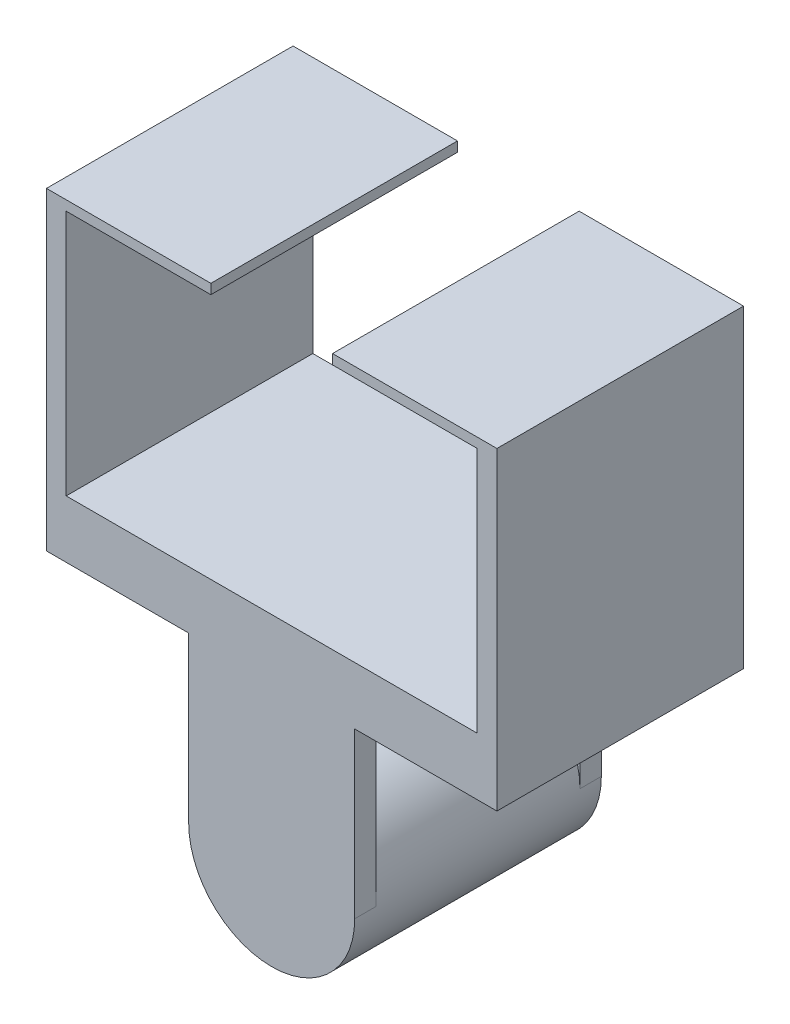
from build123d import *

# Parameters (mm, degrees)
SKETCH1_R            = 12.827
BOSS_EXTRUDE1_DEPTH  = 38.1
SKETCH2_W            = 25.654
SKETCH2_H            = 25.4
BOSS_EXTRUDE2_DEPTH  = 3.302
SKETCH8_W            = 63.5
SKETCH8_H            = 38.1
BOSS_EXTRUDE6_DEPTH  = 8.89
SKETCH10_W           = 38.1
SKETCH10_H           = 46.99
BOSS_EXTRUDE7_DEPTH  = 3.048
SKETCH11_W           = 38.1
SKETCH11_H           = 46.99
BOSS_EXTRUDE8_DEPTH  = 3.048
SKETCH13_W           = 25.4
SKETCH13_H           = 38.1
BOSS_EXTRUDE9_DEPTH  = 1.524
SKETCH14_W           = 25.4
SKETCH14_H           = 38.1
BOSS_EXTRUDE10_DEPTH = 1.524
SKETCH16_W           = 25.654
SKETCH16_H           = 25.4
BOSS_EXTRUDE12_DEPTH = 3.302


with BuildPart() as part:
    # Sketch1 → Boss-Extrude1 (new body)
    with BuildSketch(Plane.XY):
        with Locations(Location((0, -30.101764051, 0), (0, 0, 180))):
            Circle(SKETCH1_R)
    extrude(amount=BOSS_EXTRUDE1_DEPTH)

    # Sketch2 → Boss-Extrude2 (add)
    with BuildSketch(Plane.XY):
        with Locations((0, -17.401764051)):
            Rectangle(SKETCH2_W, SKETCH2_H)
    extrude(amount=BOSS_EXTRUDE2_DEPTH)

    # Sketch8 → Boss-Extrude6 (add)
    with BuildSketch(Plane(origin=(0, -4.701764051, 0), x_dir=(1, 0, 0), z_dir=(0, 1, 0))):
        with Locations((0, -19.05)):
            Rectangle(SKETCH8_W, SKETCH8_H)
    extrude(amount=BOSS_EXTRUDE6_DEPTH)

    # Sketch10 → Boss-Extrude7 (add)
    with BuildSketch(Plane(origin=(31.75, 0, 0), x_dir=(0, 0, -1), z_dir=(1, 0, 0))):
        with Locations((-19.05, 18.793235949)):
            Rectangle(SKETCH10_W, SKETCH10_H)
    extrude(amount=BOSS_EXTRUDE7_DEPTH)

    # Sketch11 → Boss-Extrude8 (add)
    with BuildSketch(Plane.ZY.offset(31.75)):
        with Locations((19.05, 18.793235949)):
            Rectangle(SKETCH11_W, SKETCH11_H)
    extrude(amount=BOSS_EXTRUDE8_DEPTH)

    # Sketch13 → Boss-Extrude9 (add)
    with BuildSketch(Plane(origin=(0, 42.288235949, 0), x_dir=(1, 0, 0), z_dir=(0, 1, 0))):
        with Locations((22.098, -19.05)):
            Rectangle(SKETCH13_W, SKETCH13_H)
    extrude(amount=BOSS_EXTRUDE9_DEPTH)

    # Sketch14 → Boss-Extrude10 (add)
    with BuildSketch(Plane(origin=(0, 42.288235949, 0), x_dir=(1, 0, 0), z_dir=(0, 1, 0))):
        with Locations((-22.098, -19.05)):
            Rectangle(SKETCH14_W, SKETCH14_H)
    extrude(amount=BOSS_EXTRUDE10_DEPTH)

    # Sketch16 → Boss-Extrude12 (add)
    with BuildSketch(Plane.XY.offset(38.1)):
        with Locations((0, -17.401764051)):
            Rectangle(SKETCH16_W, SKETCH16_H)
    extrude(amount=-BOSS_EXTRUDE12_DEPTH)


solid = part.part
